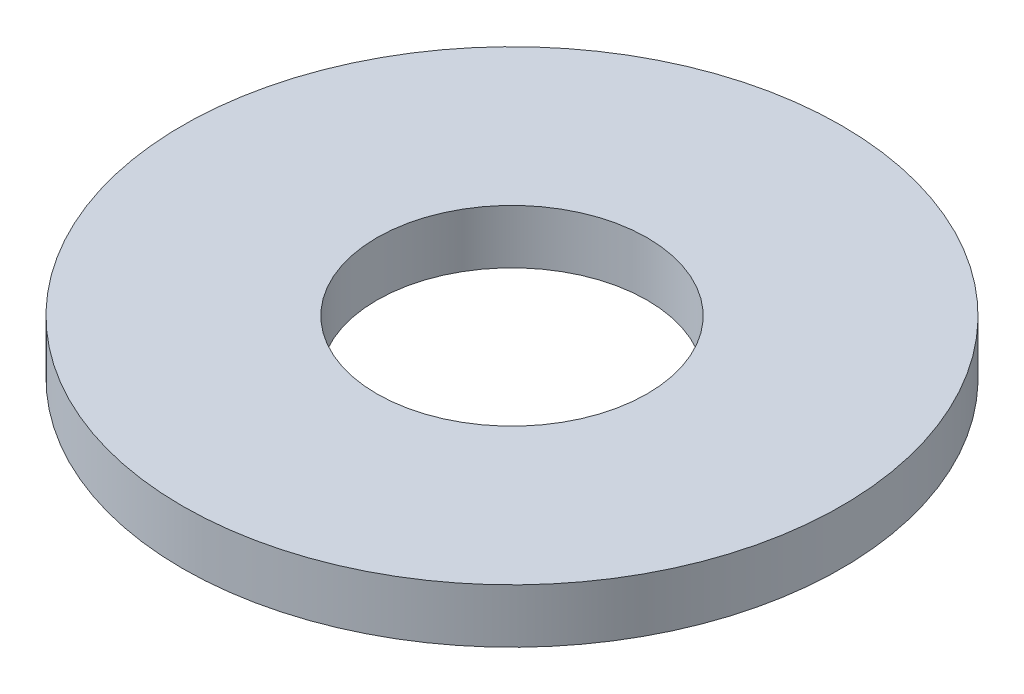
from build123d import *

# Parameters (mm, degrees)
SKETCH_1_R      = 4.875
SKETCH_1_R_2    = 2
EXTRUDE_1_DEPTH = 0.8


with BuildPart() as part:
    # ｽｹｯﾁ1 → ﾎﾞｽ - 押し出し1 (new body)
    with BuildSketch(Plane(origin=(0, 0, 0), x_dir=(1, 0, 0), z_dir=(0, 1, 0))):
        with Locations(Location((0, 0, 0), (0, 0, 270))):
            Circle(SKETCH_1_R)
        with Locations(Location((0, 0, 0), (0, 0, 270))):
            Circle(SKETCH_1_R_2, mode=Mode.SUBTRACT)
    extrude(amount=EXTRUDE_1_DEPTH)


solid = part.part
